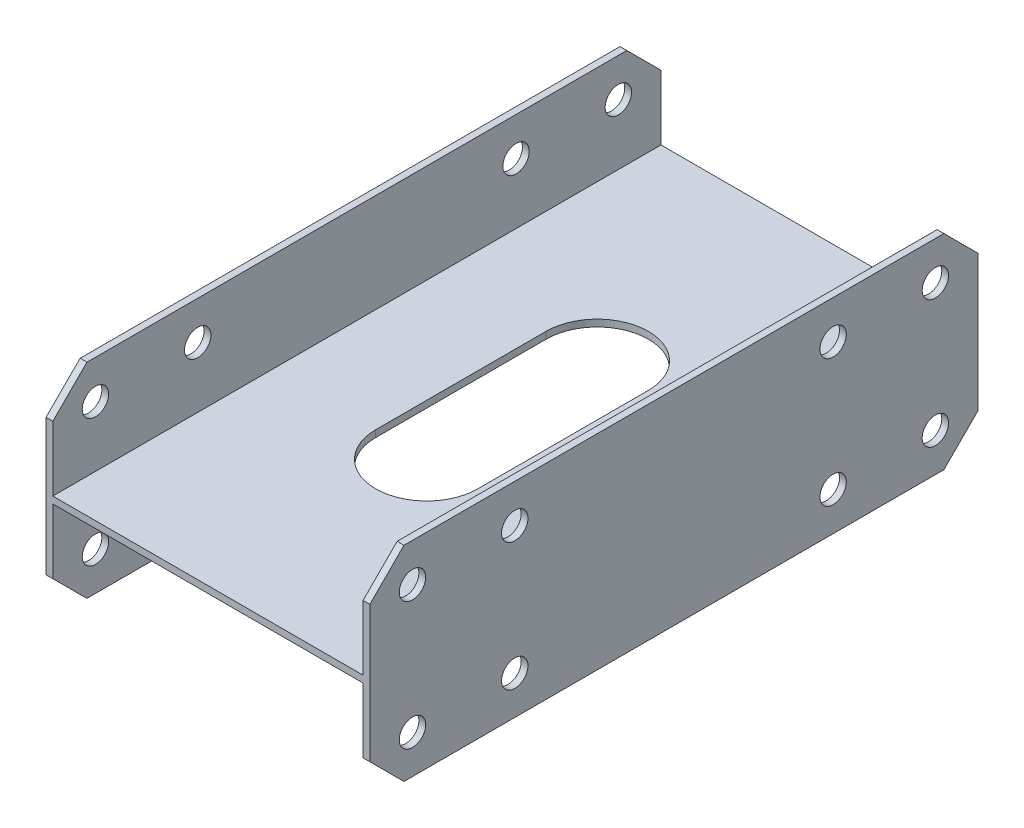
from build123d import *

# Parameters (mm, degrees)
EXTRUDE_1_DEPTH     = 713.5
SKETCH_2_R          = 15.5
CUT_EXTRUDE_2_DEPTH = 818.240631638
CUT_EXTRUDE_3_DEPTH = 749.704380914


with BuildPart() as part:
    # 草图1 → 拉伸1 (new body)
    with BuildSketch(Plane.XY):
        Polygon((-182, 120), (-190, 120), (-190, -120), (-182, -120), (-182, -4), (182, -4), (182, -120), (190, -120), (190, 120), (182, 120), (182, 4), (-182, 4), align=None)
    extrude(amount=EXTRUDE_1_DEPTH)

    # 草图2 → 拉伸2 (cut, through all)
    with BuildSketch(Plane(origin=(190, 0, 0), x_dir=(0, 0, -1), z_dir=(1, 0, 0))):
        with Locations((-663.5, 75)):
            Circle(SKETCH_2_R)
        with Locations((-543.5, 75)):
            Circle(SKETCH_2_R)
        with Locations((-663.5, -75)):
            Circle(SKETCH_2_R)
        with Locations((-543.5, -75)):
            Circle(SKETCH_2_R)
        with Locations((-170, 75)):
            Circle(SKETCH_2_R)
        with Locations((-50, 75)):
            Circle(SKETCH_2_R)
        with Locations((-50, -75)):
            Circle(SKETCH_2_R)
        with Locations((-170, -75)):
            Circle(SKETCH_2_R)
        Polygon((-673.5, 120), (-713.5, 80), (-713.5, 120), align=None)
        Polygon((-40, 120), (0, 80), (0, 120), align=None)
        Polygon((-40, -120), (0, -80), (0, -120), align=None)
        Polygon((-673.5, -120), (-713.5, -80), (-713.5, -120), align=None)
    extrude(amount=-CUT_EXTRUDE_2_DEPTH, mode=Mode.SUBTRACT)

    # 草图3 → 拉伸3 (cut, through all)
    with BuildSketch(Plane(origin=(0, 4, 0), x_dir=(1, 0, 0), z_dir=(0, 1, 0))):
        with BuildLine():
            Line((60, -256.75), (60, -456.75))
            ThreePointArc((60, -456.75), (0, -516.75), (-60, -456.75))
            Line((-60, -456.75), (-60, -256.75))
            ThreePointArc((-60, -256.75), (0, -196.75), (60, -256.75))
        make_face()
    extrude(amount=-CUT_EXTRUDE_3_DEPTH, mode=Mode.SUBTRACT)


solid = part.part
